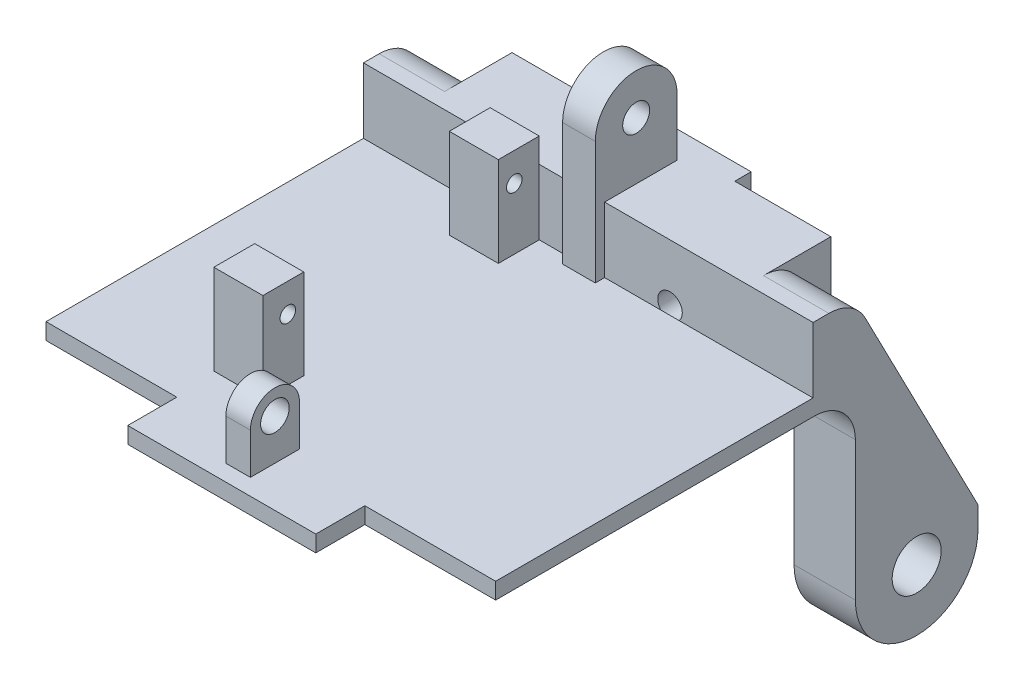
from build123d import *

# Parameters (mm, degrees)
SKETCH_1_W           = 55
SKETCH_1_H           = 39
EXTRUDE_1_DEPTH      = 2
SKETCH_2_W           = 23
SKETCH_2_H           = 6
EXTRUDE_2_DEPTH      = 2
SKETCH_3_W           = 6
SKETCH_3_H           = 5
EXTRUDE_3_DEPTH      = 11
SKETCH_5_R           = 0.95
CUT_EXTRUDE_1_DEPTH  = 11
SKETCH_6_W           = 55
SKETCH_6_H           = 0.171008225
EXTRUDE_4_DEPTH      = 8
SKETCH_8_R           = 1.65
EXTRUDE_6_DEPTH      = 2
SKETCH_10_W          = 3
SKETCH_10_H          = 6
EXTRUDE_7_DEPTH      = 8
SKETCH_11_R          = 1.5
CUT_EXTRUDE_3_DEPTH  = 13
SKETCH_12_R          = 3
EXTRUDE_8_DEPTH      = 7.5
SKETCH_13_W          = 10
SKETCH_13_H          = 3.7
EXTRUDE_9_DEPTH      = 1
FILLET_3_RADIUS      = 3
FILLET_3_LENGTH      = 3
SKETCH_15_R          = 1.75
CUT_EXTRUDE_5_DEPTH  = 23
SKETCH_16_W          = 15.5
SKETCH_16_H          = 4
EXTRUDE_10_DEPTH     = 20
SKETCH_17_R          = 1.5
EXTRUDE_11_DEPTH     = 10
FILLET_4_R           = 10
SKETCH_18_W          = 26.564734734
SKETCH_18_H          = 10.454508508
CUT_EXTRUDE_6_DEPTH  = 10
CUT_EXTRUDE_7_DEPTH  = 8
CUT_EXTRUDE_8_DEPTH  = 8
FILLET_6_R           = 5
SKETCH_22_R          = 1.4
CUT_EXTRUDE_10_DEPTH = 4


with BuildPart() as part:
    # 草图1 → 凸台-拉伸1 (new body)
    with BuildSketch(Plane(origin=(0, 0, 0), x_dir=(1, 0, 0), z_dir=(0, 1, 0))):
        Rectangle(SKETCH_1_W, SKETCH_1_H)
    extrude(amount=EXTRUDE_1_DEPTH)

    # 草图2 → 凸台-拉伸2 (add)
    with BuildSketch(Plane(origin=(0, 2, 0), x_dir=(1, 0, 0), z_dir=(0, 1, 0))):
        with Locations((0, -22.5)):
            Rectangle(SKETCH_2_W, SKETCH_2_H)
    extrude(amount=-EXTRUDE_2_DEPTH)

    # 草图3 → 凸台-拉伸3 (add)
    with BuildSketch(Plane(origin=(0, 2, 0), x_dir=(1, 0, 0), z_dir=(0, 1, 0))):
        with Locations((-9, -11.971008225)):
            Rectangle(SKETCH_3_W, SKETCH_3_H)
        with Locations((-9, 16.828991775)):
            Rectangle(SKETCH_3_W, SKETCH_3_H)
    extrude(amount=EXTRUDE_3_DEPTH)

    # 草图5 → 切除-拉伸1 (cut)
    with BuildSketch(Plane.ZY.offset(12)):
        with Locations((-16.278991775, 9.5)):
            Circle(SKETCH_5_R)
        with Locations((11.421008225, 9.5)):
            Circle(SKETCH_5_R)
    extrude(amount=-CUT_EXTRUDE_1_DEPTH, mode=Mode.SUBTRACT)

    # 草图6 → 凸台-拉伸4 (add)
    with BuildSketch(Plane(origin=(0, 2, 0), x_dir=(1, 0, 0), z_dir=(0, 1, 0))):
        with Locations((0, 19.414495888)):
            Rectangle(SKETCH_6_W, SKETCH_6_H)
    extrude(amount=EXTRUDE_4_DEPTH)

    # 草图8 → 凸台-拉伸6 (add, symmetric)
    with BuildSketch(Plane(origin=(0, 0, 0), x_dir=(0, 0, -1), z_dir=(1, 0, 0))):
        with BuildLine():
            Line((28.189872998, 17), (28.189872998, 0))
            Line((28.189872998, 0), (18.189872998, 0))
            Line((18.189872998, 0), (18.189872998, 17))
            ThreePointArc((18.189872998, 17), (23.189872998, 22), (28.189872998, 17))
        make_face()
        with Locations((23.189872998, 17)):
            Circle(SKETCH_8_R, mode=Mode.SUBTRACT)
    extrude(amount=EXTRUDE_6_DEPTH, both=True)

    # 草图10 → 凸台-拉伸7 (add)
    with BuildSketch(Plane(origin=(0, 2, 0), x_dir=(1, 0, 0), z_dir=(0, 1, 0))):
        with Locations((0, -20.5)):
            Rectangle(SKETCH_10_W, SKETCH_10_H)
    extrude(amount=EXTRUDE_7_DEPTH)

    # 草图11 → 切除-拉伸3 (cut)
    with BuildSketch(Plane.XY.offset(-19.328991775)):
        with Locations((-10, 3)):
            Circle(SKETCH_11_R)
    cut_extrude_3 = extrude(amount=-CUT_EXTRUDE_3_DEPTH, mode=Mode.SUBTRACT)

    # 草图12 → 凸台-拉伸8 (add)
    with BuildSketch(Plane.ZY.offset(27.5)):
        with BuildLine():
            Line((-39.5, -22), (-39.5, 10))
            Line((-39.5, 10), (-19.5, 10))
            Line((-19.5, 10), (-19.5, 0))
            Line((-19.5, 0), (-24.5, 0))
            Line((-24.5, 0), (-24.5, -22))
            ThreePointArc((-24.5, -22), (-32, -29.5), (-39.5, -22))
        make_face()
        with Locations((-32, -22)):
            Circle(SKETCH_12_R, mode=Mode.SUBTRACT)
    extrude_8 = extrude(amount=-EXTRUDE_8_DEPTH)

    # 草图13 → 凸台-拉伸9 (add)
    with BuildSketch(Plane.XZ):
        with Locations((0, 19.15)):
            Rectangle(SKETCH_13_W, SKETCH_13_H)
    extrude(amount=EXTRUDE_9_DEPTH)

    # 镜向1: 切除-拉伸3, 凸台-拉伸8 across plane
    add(cut_extrude_3.mirror(Plane(origin=(0, 0, 0), x_dir=(0, 0, 1), z_dir=(1, 0, 0))), mode=Mode.SUBTRACT)
    add(extrude_8.mirror(Plane(origin=(0, 0, 0), x_dir=(0, 0, 1), z_dir=(1, 0, 0))))

    # 圆角3: full round fillet: the end face becomes a half cylinder, R = half its width
    fillet_3_face = Plane((0, 10, 20.5), x_dir=(1, 0, 0), z_dir=(0, 1, 0))  # on the end face: x along it, z out of the body
    fillet_3_slab = fillet_3_face.offset(-FILLET_3_RADIUS / 2) * Box(FILLET_3_LENGTH, 2 * FILLET_3_RADIUS, FILLET_3_RADIUS, mode=Mode.PRIVATE)  # the body's end, R deep
    fillet_3_round = Plane((0, 7, 20.5), x_dir=(0, 1, 0), z_dir=(1, 0, 0)) * Cylinder(FILLET_3_RADIUS, FILLET_3_LENGTH, mode=Mode.PRIVATE)  # its axis R under the face
    add(fillet_3_slab - fillet_3_round, mode=Mode.SUBTRACT)

    # 草图15 → 切除-拉伸5 (cut)
    with BuildSketch(Plane.ZY.offset(1.5)):
        with Locations((20.5, 7)):
            Circle(SKETCH_15_R)
    extrude(amount=-CUT_EXTRUDE_5_DEPTH, mode=Mode.SUBTRACT)

    # 草图16 → 凸台-拉伸10 (add)
    with BuildSketch(Plane(origin=(0, 0, -19.5), x_dir=(-1, 0, 0), z_dir=(0, 0, -1))):
        with Locations((0, 8)):
            Rectangle(SKETCH_16_W, SKETCH_16_H)
    extrude(amount=EXTRUDE_10_DEPTH)

    # 草图17 → 凸台-拉伸11 (add)
    # profile 1 of 2: a face of its own
    with BuildSketch(Plane(origin=(0, 0, -19.5), x_dir=(-1, 0, 0), z_dir=(0, 0, -1))):
        Polygon((-20, 0), (-2, 0), (-2, 6), (-7.75, 6), (-7.75, 10), (-20, 10), align=None)
        with Locations(Location((-10, 3, 0), (0, 0, 221.810314896))):
            Circle(SKETCH_17_R, mode=Mode.SUBTRACT)
    # profile 2 of 2: a face of its own
    with BuildSketch(Plane(origin=(0, 0, -19.5), x_dir=(-1, 0, 0), z_dir=(0, 0, -1))):
        Polygon((7.75, 6), (2, 6), (2, 0), (20, 0), (20, 10), (7.75, 10), align=None)
        with Locations(Location((10, 3, 0), (0, 0, 180))):
            Circle(SKETCH_17_R, mode=Mode.SUBTRACT)
    extrude(amount=EXTRUDE_11_DEPTH)

    # 圆角4
    fillet_4_edges = [part.edges().sort_by_distance(p)[0] for p in [
        (23.75, 10, -39.5),
        (-23.75, 10, -39.5),
    ]]
    fillet(fillet_4_edges, radius=FILLET_4_R)

    # 草图18 → 切除-拉伸6 (cut)
    with BuildSketch(Plane(origin=(0, 10, 0), x_dir=(1, 0, 0), z_dir=(0, 1, 0))):
        with Locations((-0.840887807, 36.727254254)):
            Rectangle(SKETCH_18_W, SKETCH_18_H)
    extrude(amount=-CUT_EXTRUDE_6_DEPTH, mode=Mode.SUBTRACT)

    # 草图19 → 切除-拉伸7 (cut)
    with BuildSketch(Plane(origin=(27.5, 0, 0), x_dir=(0, 0, -1), z_dir=(1, 0, 0))):
        Polygon((24.3, 10), (39.5, -19.395601839), (39.5, 10), align=None)
    extrude(amount=-CUT_EXTRUDE_7_DEPTH, mode=Mode.SUBTRACT)

    # 草图20 → 切除-拉伸8 (cut)
    with BuildSketch(Plane.ZY.offset(27.5)):
        Polygon((-24.3, 10), (-39.5, 10), (-39.5, -19.395601839), align=None)
    extrude(amount=-CUT_EXTRUDE_8_DEPTH, mode=Mode.SUBTRACT)

    # 圆角6
    fillet_6_edges = [part.edges().sort_by_distance(p)[0] for p in [
        (-23.75, 0, -24.5),
        (23.75, 0, -24.5),
        (23.5, 10, -24.3),
        (-23.5, 10, -24.3),
    ]]
    fillet(fillet_6_edges, radius=FILLET_6_R)

    # 草图22 → 切除-拉伸10 (cut)
    with BuildSketch(Plane.XZ.offset(1)):
        with Locations(Location((0, 19.15, 0), (0, 0, 270))):
            Circle(SKETCH_22_R)
    extrude(amount=-CUT_EXTRUDE_10_DEPTH, mode=Mode.SUBTRACT)


solid = part.part
